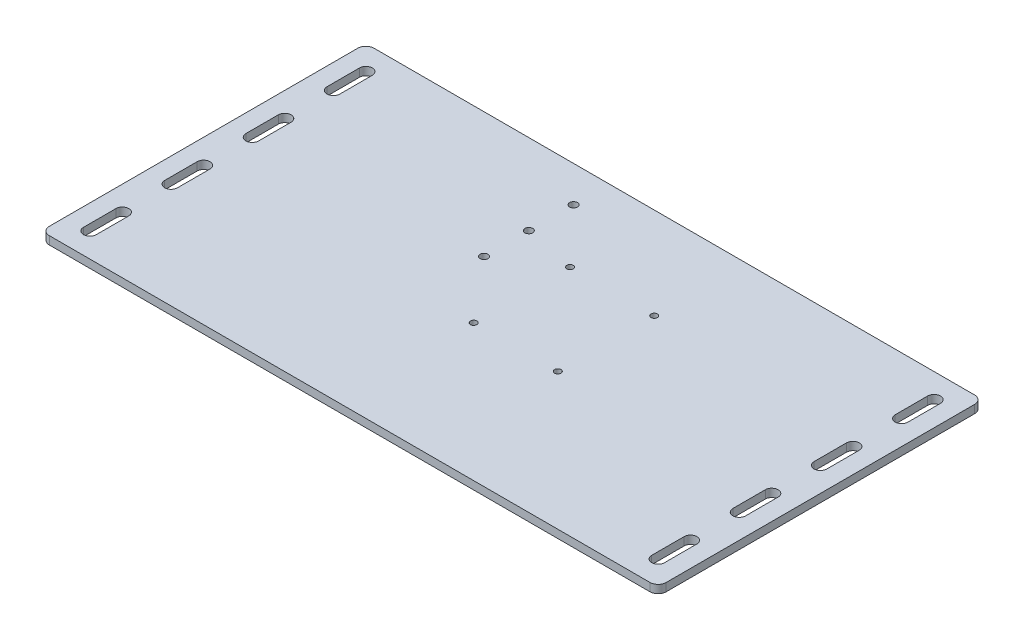
from build123d import *

# Parameters (mm, degrees)
SKETCH1_W           = 482.6
SKETCH1_H           = 254
BOSS_EXTRUDE1_DEPTH = 3.175
FILLET1_R           = 6.35
CUT_EXTRUDE1_REACH  = 274.754
SKETCH3_R           = 3.05
CUT_EXTRUDE2_DEPTH  = 273.754491255
SKETCH4_R           = 2.5
CUT_EXTRUDE3_DEPTH  = 10


with BuildPart() as part:
    # Sketch1 → Boss-Extrude1 (new, symmetric)
    with BuildSketch(Plane(origin=(0, 0, 0), x_dir=(1, 0, 0), z_dir=(0, 1, 0))):
        Rectangle(SKETCH1_W, SKETCH1_H)
    extrude(amount=BOSS_EXTRUDE1_DEPTH, both=True)

    # Fillet1
    fillet1_edges = [part.edges().sort_by_distance(p)[0] for p in [
        (241.3, 0, 127),
        (-241.3, 0, 127),
        (-241.3, 0, -127),
        (241.3, 0, -127),
    ]]
    fillet(fillet1_edges, radius=FILLET1_R)

    # Sketch2 → Cut-Extrude1 (cut, up to next)
    with BuildSketch(Plane(origin=(0, 3.175, 0), x_dir=(1, 0, 0), z_dir=(0, 1, 0)), mode=Mode.PRIVATE) as cut_extrude1_sk1:
        with BuildLine():
            Line((227.25, -82.55), (227.25, -107.95))
            ThreePointArc((227.25, -107.95), (222.25, -112.95), (217.25, -107.95))
            Line((217.25, -107.95), (217.25, -82.55))
            ThreePointArc((217.25, -82.55), (222.25, -77.55), (227.25, -82.55))
        make_face()
    cut_extrude1_tool1 = extrude(cut_extrude1_sk1.sketch, amount=-CUT_EXTRUDE1_REACH, mode=Mode.PRIVATE) & part.part
    # Sketch2 → Cut-Extrude1 (cut, up to next)
    with BuildSketch(Plane(origin=(0, 3.175, 0), x_dir=(1, 0, 0), z_dir=(0, 1, 0)), mode=Mode.PRIVATE) as cut_extrude1_sk2:
        with BuildLine():
            Line((227.25, -44.45), (227.25, -19.05))
            ThreePointArc((227.25, -19.05), (222.25, -14.05), (217.25, -19.05))
            Line((217.25, -19.05), (217.25, -44.45))
            ThreePointArc((217.25, -44.45), (222.25, -49.45), (227.25, -44.45))
        make_face()
    cut_extrude1_tool2 = extrude(cut_extrude1_sk2.sketch, amount=-CUT_EXTRUDE1_REACH, mode=Mode.PRIVATE) & part.part
    # Sketch2 → Cut-Extrude1 (cut, up to next)
    with BuildSketch(Plane(origin=(0, 3.175, 0), x_dir=(1, 0, 0), z_dir=(0, 1, 0)), mode=Mode.PRIVATE) as cut_extrude1_sk3:
        with BuildLine():
            Line((227.25, 44.45), (227.25, 19.05))
            ThreePointArc((227.25, 19.05), (222.25, 14.05), (217.25, 19.05))
            Line((217.25, 19.05), (217.25, 44.45))
            ThreePointArc((217.25, 44.45), (222.25, 49.45), (227.25, 44.45))
        make_face()
    cut_extrude1_tool3 = extrude(cut_extrude1_sk3.sketch, amount=-CUT_EXTRUDE1_REACH, mode=Mode.PRIVATE) & part.part
    # Sketch2 → Cut-Extrude1 (cut, up to next)
    with BuildSketch(Plane(origin=(0, 3.175, 0), x_dir=(1, 0, 0), z_dir=(0, 1, 0)), mode=Mode.PRIVATE) as cut_extrude1_sk4:
        with BuildLine():
            Line((227.25, 82.55), (227.25, 107.95))
            ThreePointArc((227.25, 107.95), (222.25, 112.95), (217.25, 107.95))
            Line((217.25, 107.95), (217.25, 82.55))
            ThreePointArc((217.25, 82.55), (222.25, 77.55), (227.25, 82.55))
        make_face()
    cut_extrude1_tool4 = extrude(cut_extrude1_sk4.sketch, amount=-CUT_EXTRUDE1_REACH, mode=Mode.PRIVATE) & part.part
    # Sketch2 → Cut-Extrude1 (cut, up to next)
    with BuildSketch(Plane(origin=(0, 3.175, 0), x_dir=(1, 0, 0), z_dir=(0, 1, 0)), mode=Mode.PRIVATE) as cut_extrude1_sk5:
        with BuildLine():
            Line((-227.25, 82.55), (-227.25, 107.95))
            ThreePointArc((-227.25, 107.95), (-222.25, 112.95), (-217.25, 107.95))
            Line((-217.25, 107.95), (-217.25, 82.55))
            ThreePointArc((-217.25, 82.55), (-222.25, 77.55), (-227.25, 82.55))
        make_face()
    cut_extrude1_tool5 = extrude(cut_extrude1_sk5.sketch, amount=-CUT_EXTRUDE1_REACH, mode=Mode.PRIVATE) & part.part
    # Sketch2 → Cut-Extrude1 (cut, up to next)
    with BuildSketch(Plane(origin=(0, 3.175, 0), x_dir=(1, 0, 0), z_dir=(0, 1, 0)), mode=Mode.PRIVATE) as cut_extrude1_sk6:
        with BuildLine():
            Line((-227.25, 44.45), (-227.25, 19.05))
            ThreePointArc((-227.25, 19.05), (-222.25, 14.05), (-217.25, 19.05))
            Line((-217.25, 19.05), (-217.25, 44.45))
            ThreePointArc((-217.25, 44.45), (-222.25, 49.45), (-227.25, 44.45))
        make_face()
    cut_extrude1_tool6 = extrude(cut_extrude1_sk6.sketch, amount=-CUT_EXTRUDE1_REACH, mode=Mode.PRIVATE) & part.part
    # Sketch2 → Cut-Extrude1 (cut, up to next)
    with BuildSketch(Plane(origin=(0, 3.175, 0), x_dir=(1, 0, 0), z_dir=(0, 1, 0)), mode=Mode.PRIVATE) as cut_extrude1_sk7:
        with BuildLine():
            Line((-227.25, -44.45), (-227.25, -19.05))
            ThreePointArc((-227.25, -19.05), (-222.25, -14.05), (-217.25, -19.05))
            Line((-217.25, -19.05), (-217.25, -44.45))
            ThreePointArc((-217.25, -44.45), (-222.25, -49.45), (-227.25, -44.45))
        make_face()
    cut_extrude1_tool7 = extrude(cut_extrude1_sk7.sketch, amount=-CUT_EXTRUDE1_REACH, mode=Mode.PRIVATE) & part.part
    # Sketch2 → Cut-Extrude1 (cut, up to next)
    with BuildSketch(Plane(origin=(0, 3.175, 0), x_dir=(1, 0, 0), z_dir=(0, 1, 0)), mode=Mode.PRIVATE) as cut_extrude1_sk8:
        with BuildLine():
            Line((-227.25, -82.55), (-227.25, -107.95))
            ThreePointArc((-227.25, -107.95), (-222.25, -112.95), (-217.25, -107.95))
            Line((-217.25, -107.95), (-217.25, -82.55))
            ThreePointArc((-217.25, -82.55), (-222.25, -77.55), (-227.25, -82.55))
        make_face()
    cut_extrude1_tool8 = extrude(cut_extrude1_sk8.sketch, amount=-CUT_EXTRUDE1_REACH, mode=Mode.PRIVATE) & part.part
    add(cut_extrude1_tool1.solids().sort_by_distance((222.25, 3.175, 95.25))[0], mode=Mode.SUBTRACT)
    add(cut_extrude1_tool2.solids().sort_by_distance((222.25, 3.175, 31.75))[0], mode=Mode.SUBTRACT)
    add(cut_extrude1_tool3.solids().sort_by_distance((222.25, 3.175, -31.75))[0], mode=Mode.SUBTRACT)
    add(cut_extrude1_tool4.solids().sort_by_distance((222.25, 3.175, -95.25))[0], mode=Mode.SUBTRACT)
    add(cut_extrude1_tool5.solids().sort_by_distance((-222.25, 3.175, -95.25))[0], mode=Mode.SUBTRACT)
    add(cut_extrude1_tool6.solids().sort_by_distance((-222.25, 3.175, -31.75))[0], mode=Mode.SUBTRACT)
    add(cut_extrude1_tool7.solids().sort_by_distance((-222.25, 3.175, 31.75))[0], mode=Mode.SUBTRACT)
    add(cut_extrude1_tool8.solids().sort_by_distance((-222.25, 3.175, 95.25))[0], mode=Mode.SUBTRACT)

    # Sketch3 → Cut-Extrude2 (cut, through all)
    with BuildSketch(Plane(origin=(0, 3.175, 0), x_dir=(1, 0, 0), z_dir=(0, 1, 0))):
        with Locations(Location((-50.8, 98.955999998, 0), (0, 0, 270))):
            Circle(SKETCH3_R)
        with Locations(Location((-50.8, 63.955999998, 0), (0, 0, 270))):
            Circle(SKETCH3_R)
        with Locations(Location((-50.8, 28.955999998, 0), (0, 0, 270))):
            Circle(SKETCH3_R)
    extrude(amount=-CUT_EXTRUDE2_DEPTH, mode=Mode.SUBTRACT)

    # Sketch4 → Cut-Extrude3 (cut)
    with BuildSketch(Plane.XZ.offset(-3.175)):
        with Locations(Location((55.899172715, 20.049660002, 0), (0, 0, 90))):
            Circle(SKETCH4_R)
        with Locations(Location((-9.929521758, 20.049660002, 0), (0, 0, 90))):
            Circle(SKETCH4_R)
        with Locations(Location((55.912941777, -55.350339998, 0), (0, 0, 90))):
            Circle(SKETCH4_R)
        with Locations(Location((-9.943351442, -55.363639998, 0), (0, 0, 90))):
            Circle(SKETCH4_R)
    extrude(amount=CUT_EXTRUDE3_DEPTH, mode=Mode.SUBTRACT)


solid = part.part
